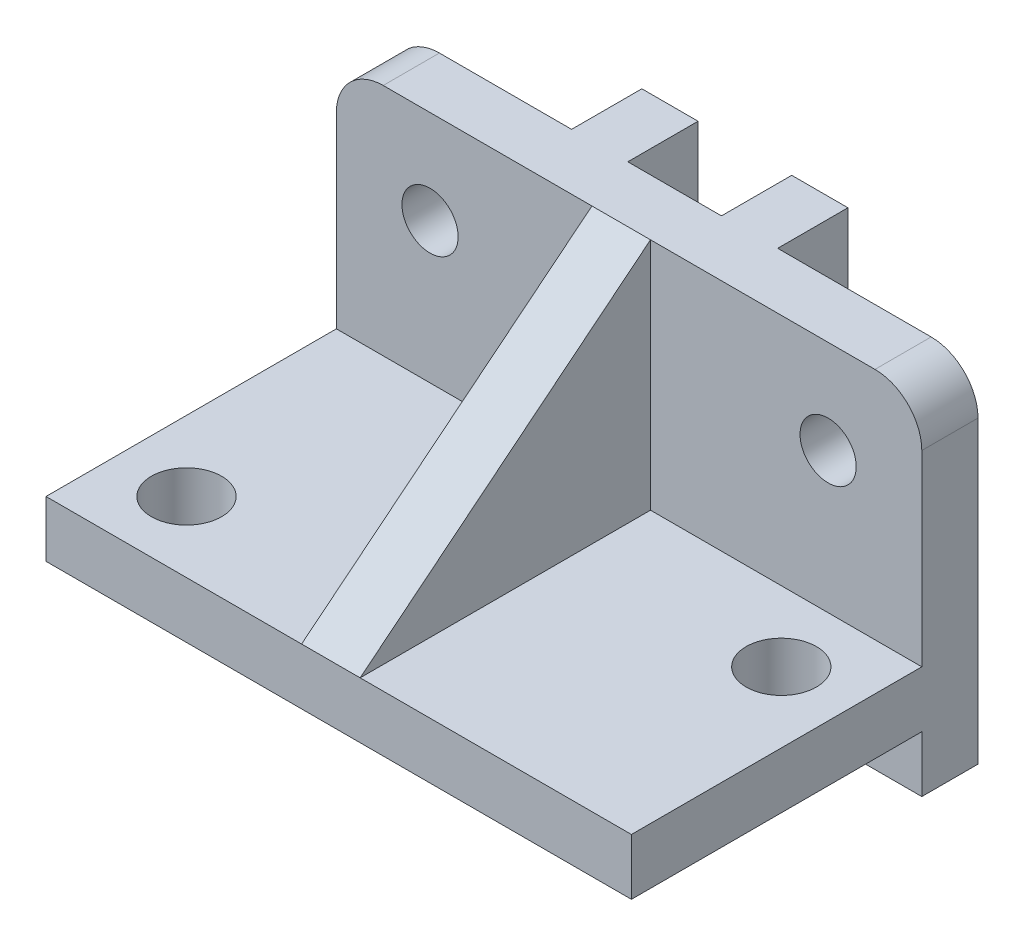
from build123d import *

# Parameters (mm, degrees)
SKETCH1_W           = 125
SKETCH1_H           = 62
SKETCH1_R           = 7.5
BOSS_EXTRUDE1_DEPTH = 12
BOSS_EXTRUDE3_DEPTH = 125
SKETCH7_W           = 12
SKETCH7_H           = 74
BOSS_EXTRUDE6_DEPTH = 15
SKETCH8_W           = 12.503423745
SKETCH8_H           = 50
BOSS_EXTRUDE7_DEPTH = 62
CUT_EXTRUDE1_DEPTH  = 62
FILLET1_R           = 10
FILLET2_R           = 10
SKETCH10_R          = 7.5
CUT_EXTRUDE2_DEPTH  = 12
SKETCH11_R          = 6
CUT_EXTRUDE3_DEPTH  = 12


with BuildPart() as part:
    # Sketch1 → Boss-Extrude1 (new body)
    with BuildSketch(Plane(origin=(0, 0, 0), x_dir=(1, 0, 0), z_dir=(0, 1, 0))):
        with Locations((62.5, 31)):
            Rectangle(SKETCH1_W, SKETCH1_H)
        with Locations(Location((15, 15, 0), (0, 0, 270))):
            Circle(SKETCH1_R, mode=Mode.SUBTRACT)
        with Locations(Location((110, 47, 0), (0, 0, 270))):
            Circle(SKETCH1_R, mode=Mode.SUBTRACT)
    extrude(amount=BOSS_EXTRUDE1_DEPTH)

    # Sketch2 → Boss-Extrude3 (add)
    with BuildSketch(Plane(origin=(125, 0, 0), x_dir=(0, 0, -1), z_dir=(1, 0, 0))):
        Polygon((62, 0), (62, -12), (74, -12), (74, 62), (62, 62), (62, 12), (0, 12), (0, 0), align=None)
    extrude(amount=-BOSS_EXTRUDE3_DEPTH)

    # Sketch7 → Boss-Extrude6 (add)
    with BuildSketch(Plane(origin=(0, 0, -74), x_dir=(-1, 0, 0), z_dir=(0, 0, -1))):
        with Locations((-76.226215006, 25)):
            Rectangle(SKETCH7_W, SKETCH7_H)
        with Locations((-44.226215006, 25)):
            Rectangle(SKETCH7_W, SKETCH7_H)
    extrude(amount=BOSS_EXTRUDE6_DEPTH)

    # Sketch8 → Boss-Extrude7 (add)
    with BuildSketch(Plane.XY.offset(-62)):
        with Locations((60.823295538, 37)):
            Rectangle(SKETCH8_W, SKETCH8_H)
    extrude(amount=BOSS_EXTRUDE7_DEPTH)

    # Sketch9 → Cut-Extrude1 (cut)
    with BuildSketch(Plane(origin=(67.07500741, 0, 0), x_dir=(0, 0, -1), z_dir=(1, 0, 0))):
        Polygon((0, 12), (62, 62), (0, 62), align=None)
    extrude(amount=-CUT_EXTRUDE1_DEPTH, mode=Mode.SUBTRACT)

    # Fillet1
    fillet1_edges = [part.edges().sort_by_distance(p)[0] for p in [
        (125, 62, -68),
    ]]
    fillet(fillet1_edges, radius=FILLET1_R)

    # Fillet2
    fillet2_edges = [part.edges().sort_by_distance(p)[0] for p in [
        (0, 62, -68),
    ]]
    fillet(fillet2_edges, radius=FILLET2_R)

    # Sketch10 → Cut-Extrude2 (cut)
    with BuildSketch(Plane(origin=(0, 12, 0), x_dir=(1, 0, 0), z_dir=(0, 1, 0))):
        with Locations(Location((15, 15, 0), (0, 0, 270))):
            Circle(SKETCH10_R)
        with Locations(Location((110, 47, 0), (0, 0, 270))):
            Circle(SKETCH10_R)
    extrude(amount=-CUT_EXTRUDE2_DEPTH, mode=Mode.SUBTRACT)

    # Sketch11 → Cut-Extrude3 (cut)
    with BuildSketch(Plane.XY.offset(-62)):
        with Locations((105, 42)):
            Circle(SKETCH11_R)
        with Locations((20, 42)):
            Circle(SKETCH11_R)
    extrude(amount=-CUT_EXTRUDE3_DEPTH, mode=Mode.SUBTRACT)


solid = part.part
